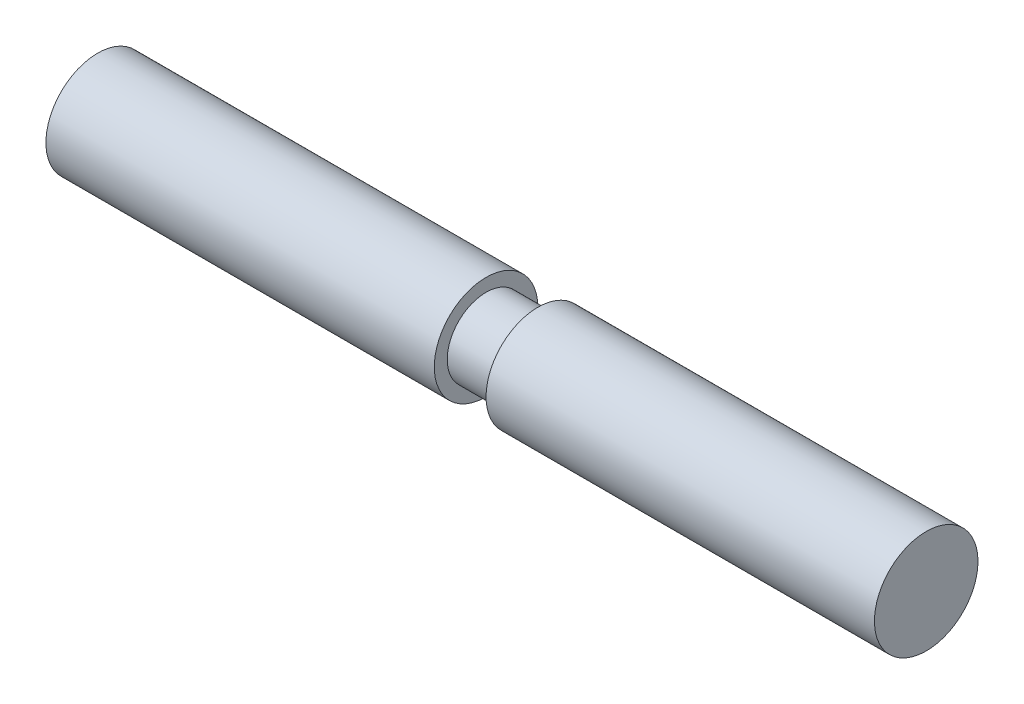
from build123d import *

# Parameters (mm, degrees)
SKETCH3_R           = 6
BOSS_EXTRUDE1_DEPTH = 96
SKETCH4_R           = 7.659234512
SKETCH4_R_2         = 4.5
CUT_EXTRUDE1_DEPTH  = 3


with BuildPart() as part:
    # Sketch3 → Boss-Extrude1 (new body)
    with BuildSketch(Plane(origin=(24, 0, 0), x_dir=(0, 0, -1), z_dir=(1, 0, 0))):
        Circle(SKETCH3_R)
    extrude(amount=-BOSS_EXTRUDE1_DEPTH)

    # Sketch4 → Cut-Extrude1 (cut, symmetric)
    with BuildSketch(Plane(origin=(-24, 0, 0), x_dir=(0, 0, -1), z_dir=(1, 0, 0))):
        Circle(SKETCH4_R)
        Circle(SKETCH4_R_2, mode=Mode.SUBTRACT)
    extrude(amount=CUT_EXTRUDE1_DEPTH, both=True, mode=Mode.SUBTRACT)


solid = part.part
